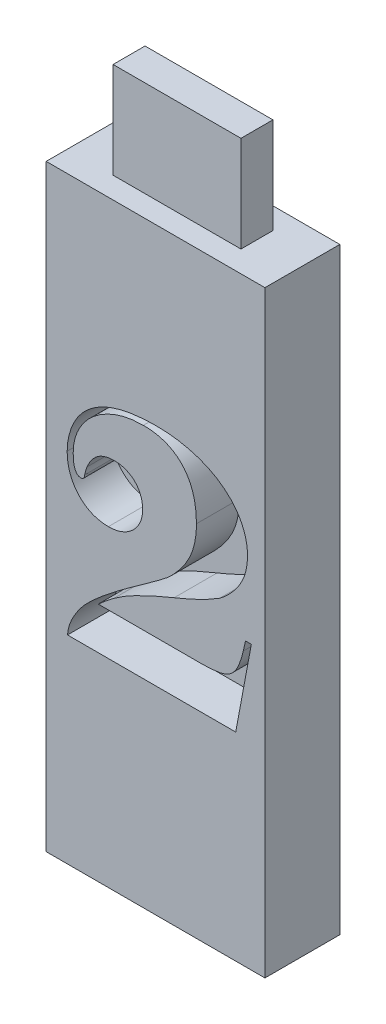
from build123d import *

# Parameters (mm, degrees)
SKETCH1_W           = 17.38
SKETCH1_H           = 47.498
BOSS_EXTRUDE1_DEPTH = 5.95
CUT_EXTRUDE1_DEPTH  = 3.41
SKETCH3_W           = 10.16
SKETCH3_H           = 2.54
BOSS_EXTRUDE2_DEPTH = 7.62


with BuildPart() as part:
    # Sketch1 → Boss-Extrude1 (new body)
    with BuildSketch(Plane.XY):
        Rectangle(SKETCH1_W, SKETCH1_H)
    extrude(amount=BOSS_EXTRUDE1_DEPTH)

    # Sketch2 → Cut-Extrude1 (cut)
    with BuildSketch(Plane.XY.offset(5.95)):
        with BuildLine():
            Line((7.610682585, -1.330357549), (6.368025877, -7.987713605))
            Line((6.368025877, -7.987713605), (-6.995198359, -7.987713605))
            add(Edge.make_bspline(
                [(-6.995198359, -7.987713605), (-6.98527537, -7.882833797), (-6.96510938, -7.669691842), (-6.886004567, -7.34876706), (-6.773079219, -7.019431862), (-6.624180262, -6.680619199), (-6.434110028, -6.335457361), (-6.210149453, -5.981323662), (-5.948482874, -5.618591158), (-5.7527101, -5.381872375), (-5.651785702, -5.259839571)],
                knots=[0, 0, 0, 0, 0.817064301, 1.660478667, 2.558483035, 3.518594198, 4.529953757, 5.615221171, 6.770603476, 8, 8, 8, 8], degree=3))
            add(Edge.make_bspline(
                [(-5.651785702, -5.259839571), (-5.545912518, -5.146798865), (-5.319121168, -4.904653937), (-4.93058814, -4.539918008), (-4.479998989, -4.141834773), (-3.962563892, -3.712515726), (-3.38093885, -3.250089743), (-2.730974475, -2.758041761), (-2.013762616, -2.236891683), (-1.51243516, -1.880913998), (-1.25210925, -1.696064328)],
                knots=[0, 0, 0, 0, 0.655262326, 1.403639932, 2.253881698, 3.199461417, 4.248439165, 5.398086362, 6.648895991, 8, 8, 8, 8], degree=3))
            add(Edge.make_bspline(
                [(-1.25210925, -1.696064328), (-1.11018432, -1.594231156), (-0.83948841, -1.400002958), (-0.457855646, -1.122264828), (-0.119925993, -0.872459095), (0.177417006, -0.659498867), (0.429785752, -0.47139578), (0.635980848, -0.311418393), (0.801967674, -0.185551942), (0.895039861, -0.109070085), (0.93466802, -0.076505736)],
                knots=[0, 0, 0, 0, 1.540409765, 2.938050592, 4.162306215, 5.246224876, 6.163269201, 6.937758442, 7.54772012, 8, 8, 8, 8], degree=3))
            add(Edge.make_bspline(
                [(0.93466802, -0.076505736), (0.962117519, -0.050473204), (1.020844738, 0.005222464), (1.114137038, 0.097453467), (1.227182083, 0.194275558), (1.302109904, 0.268772181), (1.341423519, 0.307859552)],
                knots=[0, 0, 0, 0, 0.811124387, 1.735371487, 2.811780027, 4, 4, 4, 4], degree=3))
            add(Edge.make_bspline(
                [(1.341423519, 0.307859552), (1.502379848, 0.481928668), (1.814066733, 0.819008053), (2.217536106, 1.349806026), (2.550331198, 1.878621551), (2.812851779, 2.412349816), (3.010542518, 2.963216315), (3.146031319, 3.541741638), (3.236363982, 4.152406459), (3.244277795, 4.571613077), (3.248323151, 4.785901742)],
                knots=[0, 0, 0, 0, 1.13627249, 2.200356047, 3.191695068, 4.127982156, 5.046760555, 5.991426175, 6.973263815, 8, 8, 8, 8], degree=3))
            add(Edge.make_bspline(
                [(3.248323151, 4.785901742), (3.244307765, 4.968855232), (3.236535511, 5.322983329), (3.189009802, 5.838457155), (3.10424299, 6.321969109), (2.980455393, 6.77194375), (2.829366804, 7.191397001), (2.636338948, 7.5741343), (2.413051479, 7.926923064), (2.153697026, 8.246138777), (1.863668202, 8.529926233), (1.541517202, 8.77442408), (1.195004351, 8.985047382), (0.815402866, 9.153035346), (0.409756201, 9.28822821), (-0.027275476, 9.379704657), (-0.490560035, 9.436793044), (-0.809106374, 9.443409224), (-0.972231613, 9.446797322)],
                knots=[0, 0, 0, 0, 1.226922277, 2.374853043, 3.467887334, 4.514083202, 5.501143483, 6.45241352, 7.382640638, 8.295882427, 9.204311414, 10.096900111, 11.002452191, 11.917178525, 12.874718497, 13.864559383, 14.906456551, 16, 16, 16, 16], degree=3))
            add(Edge.make_bspline(
                [(-0.972231613, 9.446797322), (-1.22141974, 9.438381944), (-1.713789063, 9.42175405), (-2.437281638, 9.305536467), (-3.130367644, 9.104941984), (-3.786631161, 8.830981562), (-4.394067691, 8.490383075), (-4.937155572, 8.086581941), (-5.41548792, 7.630208646), (-5.818644422, 7.118879338), (-6.141021546, 6.566201574), (-6.375325507, 5.982241761), (-6.519476805, 5.370047866), (-6.535548617, 4.952114244), (-6.543662438, 4.74112132)],
                knots=[0, 0, 0, 0, 1.107692178, 2.18868232, 3.247592344, 4.308522088, 5.343597231, 6.33570756, 7.309586791, 8.274316377, 9.220917521, 10.144113506, 11.063059547, 12, 12, 12, 12], degree=3))
            add(Edge.make_bspline(
                [(-6.543662438, 4.74112132), (-6.541110325, 4.6316023), (-6.536346071, 4.427153467), (-6.512355, 4.141073915), (-6.467695303, 3.897929648), (-6.3951056, 3.700354951), (-6.311043142, 3.540898653), (-6.20219968, 3.423355652), (-6.066378617, 3.354574749), (-5.969706353, 3.346066597), (-5.920468233, 3.341733136)],
                knots=[0, 0, 0, 0, 1.55763285, 2.907770881, 4.080398805, 5.059765758, 5.891388472, 6.629512922, 7.301969319, 8, 8, 8, 8], degree=3))
            add(Edge.make_bspline(
                [(-5.920468233, 3.341733136), (-5.881912075, 3.345553484), (-5.804779169, 3.35319622), (-5.707494315, 3.433490824), (-5.653903123, 3.560908194), (-5.638198818, 3.657195853), (-5.629395491, 3.711171617)],
                knots=[0, 0, 0, 0, 0.876781237, 1.754030715, 2.740981889, 4, 4, 4, 4], degree=3))
            add(Edge.make_bspline(
                [(-5.629395491, 3.711171617), (-5.608443275, 3.816417756), (-5.565641388, 4.031418095), (-5.489263487, 4.236922531), (-5.450273803, 4.341829225)],
                knots=[0, 0, 0, 0, 0.979032315, 2, 2, 2, 2], degree=3))
            add(Edge.make_bspline(
                [(-5.450273803, 4.341829225), (-5.392110498, 4.466406191), (-5.280638811, 4.705161615), (-5.075641895, 5.026644114), (-4.841858605, 5.289843425), (-4.587618112, 5.506430798), (-4.301124601, 5.668923715), (-3.983804616, 5.785629207), (-3.633220449, 5.852328243), (-3.38941444, 5.860264665), (-3.263496534, 5.86436357)],
                knots=[0, 0, 0, 0, 1.156027167, 2.215560106, 3.194165498, 4.108010317, 5.012761327, 5.949802064, 6.941139173, 8, 8, 8, 8], degree=3))
            add(Edge.make_bspline(
                [(-3.263496534, 5.86436357), (-3.157551359, 5.860639596), (-2.95055242, 5.853363582), (-2.648004945, 5.800330441), (-2.363367363, 5.710594598), (-2.098299445, 5.58647246), (-1.852430666, 5.435434019), (-1.640551995, 5.24462352), (-1.448370562, 5.032209332), (-1.299989702, 4.783554717), (-1.174049135, 4.51982214), (-1.089620697, 4.236424672), (-1.0356218, 3.94086253), (-1.028220086, 3.738776284), (-1.024475439, 3.63653758)],
                knots=[0, 0, 0, 0, 1.075908979, 2.10214405, 3.109218953, 4.098538901, 5.069614967, 6.027696972, 6.985778976, 7.967565613, 8.956885561, 9.948140296, 10.96193095, 12, 12, 12, 12], degree=3))
            add(Edge.make_bspline(
                [(-1.024475439, 3.63653758), (-1.028672403, 3.519307822), (-1.03691531, 3.289066618), (-1.105476164, 2.951442001), (-1.224107596, 2.632969721), (-1.378825019, 2.329847926), (-1.577355262, 2.055363779), (-1.807514749, 1.808717202), (-2.071174882, 1.596129975), (-2.361921399, 1.412148891), (-2.679623596, 1.267274809), (-3.017746099, 1.161175587), (-3.377107425, 1.101849589), (-3.622774306, 1.09254932), (-3.748617771, 1.087785234)],
                knots=[0, 0, 0, 0, 1.01412685, 1.991762083, 2.96589313, 3.948259837, 4.928263663, 5.888008524, 6.859935583, 7.851697524, 8.858597316, 9.873409774, 10.910648925, 12, 12, 12, 12], degree=3))
            add(Edge.make_bspline(
                [(-3.748617771, 1.087785234), (-3.865742314, 1.090118901), (-4.094836802, 1.094683532), (-4.43077264, 1.14635424), (-4.750947185, 1.2233476), (-5.056325546, 1.330785652), (-5.342038972, 1.476425321), (-5.614820606, 1.646589357), (-5.871292117, 1.850782693), (-6.107148326, 2.084903925), (-6.323974971, 2.340842051), (-6.511528872, 2.618659653), (-6.668260719, 2.914206912), (-6.795916795, 3.227084412), (-6.895524315, 3.555846439), (-6.972699989, 3.900891535), (-7.011846518, 4.265041725), (-7.018115717, 4.513409889), (-7.021320272, 4.640365371)],
                knots=[0, 0, 0, 0, 1.037468583, 2.02927865, 3.005457007, 3.954156769, 4.891120652, 5.842572036, 6.800074553, 7.790350972, 8.784304171, 9.769101414, 10.755687349, 11.744735136, 12.759751057, 13.797922611, 14.874389564, 16, 16, 16, 16], degree=3))
            add(Edge.make_bspline(
                [(-7.021320272, 4.640365371), (-7.016990201, 4.796086782), (-7.008324672, 5.107723375), (-6.938779878, 5.571472809), (-6.825506282, 6.03089585), (-6.669453599, 6.483037568), (-6.473332668, 6.922784062), (-6.234124134, 7.338512133), (-5.951992599, 7.726105519), (-5.737363212, 7.962219212), (-5.629395491, 8.080994454)],
                knots=[0, 0, 0, 0, 0.982507668, 1.966237926, 2.952596309, 3.965591158, 4.981168749, 5.987111123, 6.987431175, 8, 8, 8, 8], degree=3))
            add(Edge.make_bspline(
                [(-5.629395491, 8.080994454), (-5.468922736, 8.229867092), (-5.145338238, 8.530060591), (-4.58307319, 8.902362583), (-3.963500442, 9.220912911), (-3.281328351, 9.481310507), (-2.537435256, 9.682644979), (-1.731501876, 9.821022847), (-0.863431101, 9.908064858), (-0.26342678, 9.918872271), (0.046522985, 9.924455156)],
                knots=[0, 0, 0, 0, 0.85679862, 1.727687372, 2.632658504, 3.583414369, 4.584069195, 5.648599755, 6.785315492, 8, 8, 8, 8], degree=3))
            add(Edge.make_bspline(
                [(0.046522985, 9.924455156), (0.306719763, 9.921111478), (0.817047485, 9.914553473), (1.56705613, 9.834643406), (2.288985571, 9.719662671), (2.978215837, 9.546507866), (3.630073019, 9.332393261), (4.237130912, 9.074650938), (4.797488211, 8.776647803), (5.304425604, 8.432432654), (5.762125507, 8.054289972), (6.169000844, 7.645739717), (6.509053841, 7.195516091), (6.798568748, 6.721871567), (7.027911469, 6.221387804), (7.188469309, 5.696840495), (7.289062288, 5.151724903), (7.3019072, 4.78011806), (7.308414737, 4.591853247)],
                knots=[0, 0, 0, 0, 1.242580118, 2.43709044, 3.599731019, 4.732646891, 5.828288251, 6.874730082, 7.879785094, 8.855581396, 9.796834188, 10.712968177, 11.603255119, 12.485892447, 13.360873831, 14.225562272, 15.101027897, 16, 16, 16, 16], degree=3))
            add(Edge.make_bspline(
                [(7.308414737, 4.591853247), (7.304687516, 4.454844123), (7.297307594, 4.183565192), (7.24252545, 3.781703872), (7.158989272, 3.389911855), (7.034234887, 3.01011363), (6.872747223, 2.643477585), (6.676124465, 2.287740007), (6.451320626, 1.938310042), (6.272098886, 1.72291255), (6.181440786, 1.613955191)],
                knots=[0, 0, 0, 0, 1.010030978, 1.999867712, 2.985829314, 3.960461594, 4.942104315, 5.935504676, 6.955689057, 8, 8, 8, 8], degree=3))
            add(Edge.make_bspline(
                [(6.181440786, 1.613955191), (6.017781314, 1.425297604), (5.688170736, 1.04534076), (5.291498774, 0.736012983), (5.091783853, 0.580273785)],
                knots=[0, 0, 0, 0, 0.99304745, 2, 2, 2, 2], degree=3))
            add(Edge.make_bspline(
                [(5.091783853, 0.580273785), (4.985247184, 0.513617454), (4.76202927, 0.373957678), (4.402820365, 0.169956872), (4.008692264, -0.042122155), (3.575938818, -0.260470618), (3.104163755, -0.48127372), (2.595726974, -0.713419729), (2.051624313, -0.952923648), (1.673882058, -1.10849573), (1.479496486, -1.18855288)],
                knots=[0, 0, 0, 0, 0.748885685, 1.569081357, 2.461293797, 3.416108566, 4.457374262, 5.56540194, 6.747159659, 8, 8, 8, 8], degree=3))
            add(Edge.make_bspline(
                [(1.479496486, -1.18855288), (1.205555472, -1.302305263), (0.675930662, -1.522228828), (-0.085001869, -1.851231796), (-0.778363898, -2.17809917), (-1.410771004, -2.485937115), (-1.978205979, -2.784661817), (-2.483668656, -3.069174259), (-2.921481251, -3.349914389), (-3.187067094, -3.539770447), (-3.312008657, -3.629085873)],
                knots=[0, 0, 0, 0, 1.320870789, 2.553710127, 3.691121811, 4.734038825, 5.685480307, 6.546347513, 7.316147228, 8, 8, 8, 8], degree=3))
            add(Edge.make_bspline(
                [(-3.312008657, -3.629085873), (-3.378321471, -3.677091676), (-3.540009339, -3.794142295), (-3.811304773, -4.015103331), (-4.161134722, -4.30311447), (-4.414656319, -4.522790932), (-4.554665365, -4.64410877)],
                knots=[0, 0, 0, 0, 0.611967112, 1.492134803, 2.615014187, 4, 4, 4, 4], degree=3))
            Line((-4.554665365, -4.64410877), (3.688663967, -4.64410877))
            add(Edge.make_bspline(
                [(3.688663967, -4.64410877), (3.869166892, -4.643258149), (4.207083537, -4.641665717), (4.678857407, -4.596960073), (5.084673803, -4.543508968), (5.429465147, -4.454820602), (5.724155714, -4.327853762), (5.981300638, -4.163873868), (6.201173672, -3.952677612), (6.391853963, -3.699212988), (6.558312618, -3.390197595), (6.705637476, -3.020225359), (6.855363134, -2.588401323), (6.931822432, -2.274046479), (6.972561573, -2.106551529)],
                knots=[0, 0, 0, 0, 1.382564889, 2.58827766, 3.629066715, 4.517008228, 5.306858659, 6.078963914, 6.840939458, 7.630271974, 8.500641028, 9.522129242, 10.679737733, 12, 12, 12, 12], degree=3))
            Line((6.972561573, -2.106551529), (7.147951558, -1.330357549))
            Line((7.147951558, -1.330357549), (7.610682585, -1.330357549))
        make_face()
    extrude(amount=-CUT_EXTRUDE1_DEPTH, mode=Mode.SUBTRACT)

    # Sketch3 → Boss-Extrude2 (add)
    with BuildSketch(Plane(origin=(0, 23.749, 0), x_dir=(1, 0, 0), z_dir=(0, 1, 0))):
        with Locations((0, -2.975)):
            Rectangle(SKETCH3_W, SKETCH3_H)
    extrude(amount=BOSS_EXTRUDE2_DEPTH)


solid = part.part
